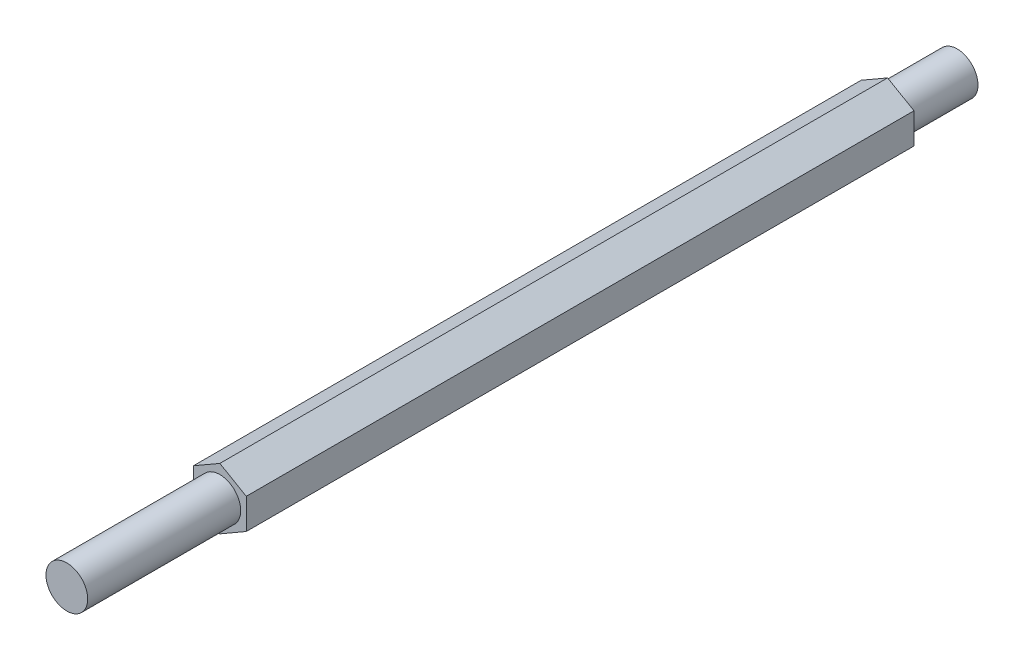
from build123d import *

# Parameters (mm, degrees)
BOSS_EXTRU_1_DEPTH      = 320
ESQUISSE2_R             = 10.969655115
ESQUISSE2_R_2           = 7.5
ENL_V_MAT_EXTRU_1_DEPTH = 55
ENL_V_START             = -295
ESQUISSE2_2_R           = 10.969655115
ESQUISSE2_2_R_2         = 7.5
ENL_V_MAT_EXTRU_2_DEPTH = 25


with BuildPart() as part:
    # Esquisse1 → Boss.-Extru.1 (new body)
    with BuildSketch(Plane.XY):
        Polygon((9.5, -5.484827557), (9.5, 5.484827557), (0, 10.969655115), (-9.5, 5.484827557), (-9.5, -5.484827557), (0, -10.969655115), align=None)
    extrude(amount=BOSS_EXTRU_1_DEPTH)

    # Esquisse2 → Enlèv. mat.-Extru.1 (cut)
    with BuildSketch(Plane.XY.offset(320)):
        Circle(ESQUISSE2_R)
        Circle(ESQUISSE2_R_2, mode=Mode.SUBTRACT)
    extrude(amount=-ENL_V_MAT_EXTRU_1_DEPTH, mode=Mode.SUBTRACT)

    # Esquisse2<2> → Enlèv. mat.-Extru.2 (cut)
    with BuildSketch(Plane.XY.offset(320).offset(ENL_V_START)):
        Circle(ESQUISSE2_2_R)
        Circle(ESQUISSE2_2_R_2, mode=Mode.SUBTRACT)
    extrude(amount=-ENL_V_MAT_EXTRU_2_DEPTH, mode=Mode.SUBTRACT)


solid = part.part
